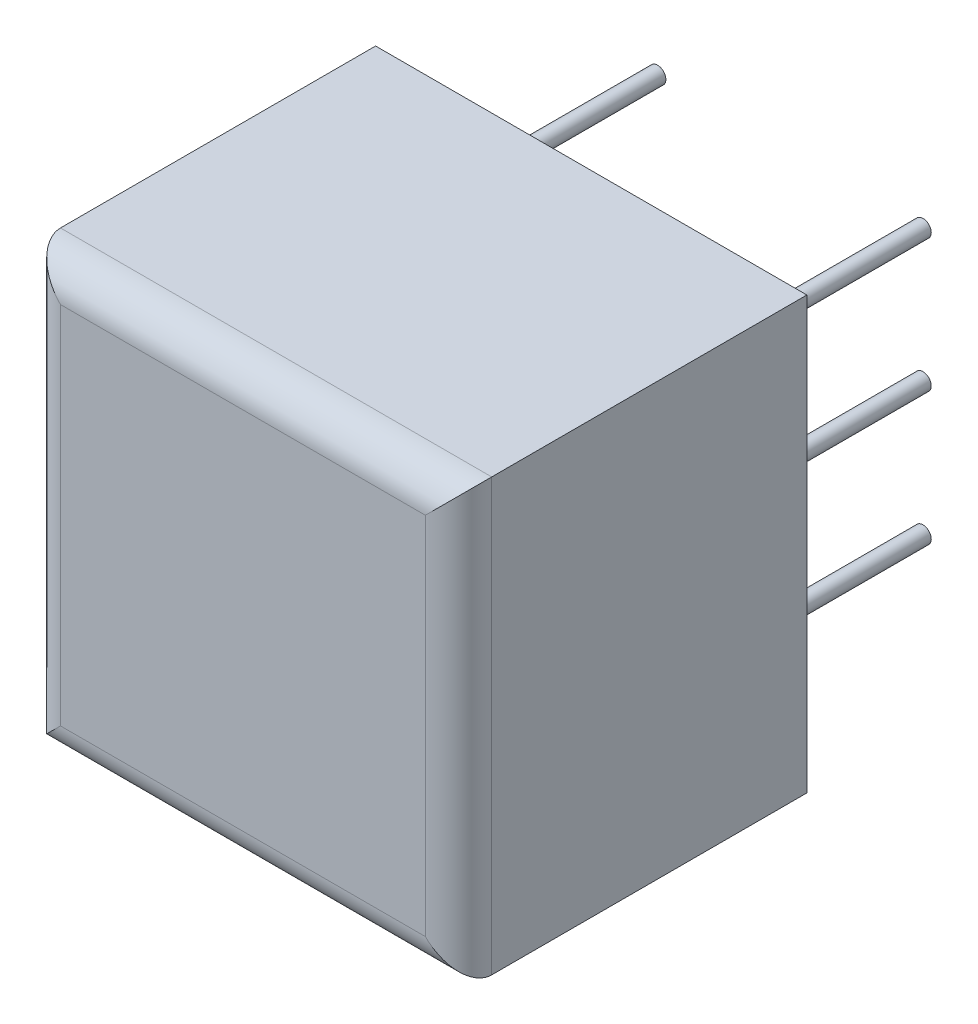
from build123d import *

# Parameters (mm, degrees)
SKETCH_1_W      = 26
SKETCH_1_H      = 26
EXTRUDE_1_DEPTH = 21
FILLET_1_R      = 2
SKETCH_2_R      = 0.5
EXTRUDE_2_DEPTH = 12


with BuildPart() as part:
    # 草图1 → 凸台-拉伸1 (new body)
    with BuildSketch(Plane.XY):
        Rectangle(SKETCH_1_W, SKETCH_1_H)
    extrude(amount=EXTRUDE_1_DEPTH)

    # 圆角1
    fillet_1_edges = [part.edges().sort_by_distance(p)[0] for p in [
        (13, 0, 21),
        (0, 13, 21),
        (-13, 0, 21),
        (0, -13, 21),
    ]]
    fillet(fillet_1_edges, radius=FILLET_1_R)

    # 草图2 → 凸台-拉伸2 (add)
    with BuildSketch(Plane(origin=(0, 0, 0), x_dir=(-1, 0, 0), z_dir=(0, 0, -1))):
        with Locations(Location((-8, 8, 0), (0, 0, 180))):
            Circle(SKETCH_2_R)
        with Locations(Location((-8, 0, 0), (0, 0, 180))):
            Circle(SKETCH_2_R)
        with Locations(Location((-8, -8, 0), (0, 0, 180))):
            Circle(SKETCH_2_R)
        with Locations(Location((8, -8, 0), (0, 0, 180))):
            Circle(SKETCH_2_R)
        with Locations(Location((8, 8, 0), (0, 0, 180))):
            Circle(SKETCH_2_R)
    extrude(amount=EXTRUDE_2_DEPTH)


solid = part.part
